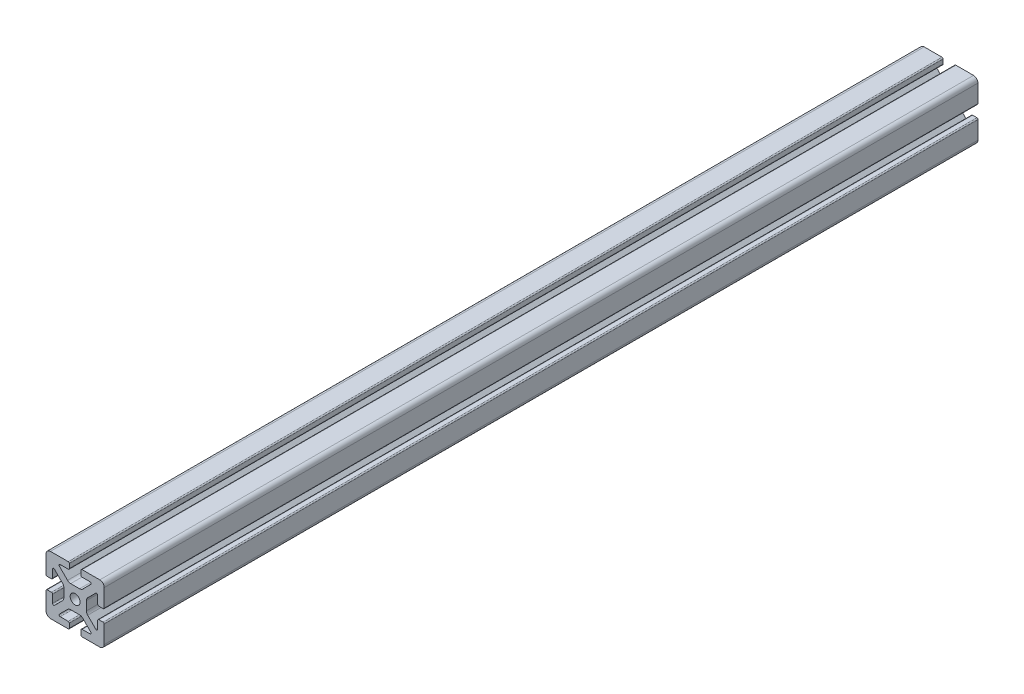
from build123d import *

# Parameters (mm, degrees)
SKETCH1_R           = 3.4036
BOSS_EXTRUDE1_DEPTH = 300


with BuildPart() as part:
    # Sketch1 → Boss-Extrude1 (new, symmetric)
    with BuildSketch(Plane.XY):
        with BuildLine():
            Line((-20, 16.952), (-20, 4.7625))
            ThreePointArc((-20, 4.7625), (-19.776815367, 4.223684633), (-19.238, 4.0005))
            Line((-19.238, 4.0005), (-16.2662, 4.0005))
            ThreePointArc((-16.2662, 4.0005), (-15.727384633, 4.223684633), (-15.5042, 4.7625))
            Line((-15.5042, 4.7625), (-15.5042, 10.2235))
            ThreePointArc((-15.5042, 10.2235), (-15.033804775, 10.927496204), (-14.203384633, 10.762315367))
            Line((-14.203384633, 10.762315367), (-8.635059555, 5.19399029))
            ThreePointArc((-8.635059555, 5.19399029), (-7.985348265, 4.221628629), (-7.7572, 3.074649845))
            Line((-7.7572, 3.074649845), (-7.7572, -3.074649845))
            ThreePointArc((-7.7572, -3.074649845), (-7.985348265, -4.221628629), (-8.635059555, -5.19399029))
            Line((-8.635059555, -5.19399029), (-14.203384633, -10.762315367))
            ThreePointArc((-14.203384633, -10.762315367), (-15.033804775, -10.927496204), (-15.5042, -10.2235))
            Line((-15.5042, -10.2235), (-15.5042, -4.7625))
            ThreePointArc((-15.5042, -4.7625), (-15.727384633, -4.223684633), (-16.2662, -4.0005))
            Line((-16.2662, -4.0005), (-19.238, -4.0005))
            ThreePointArc((-19.238, -4.0005), (-19.776815367, -4.223684633), (-20, -4.7625))
            Line((-20, -4.7625), (-20, -16.952))
            ThreePointArc((-20, -16.952), (-19.107261469, -19.107261469), (-16.952, -20))
            Line((-16.952, -20), (-4.7625, -20))
            ThreePointArc((-4.7625, -20), (-4.223684633, -19.776815367), (-4.0005, -19.238))
            Line((-4.0005, -19.238), (-4.0005, -16.2662))
            ThreePointArc((-4.0005, -16.2662), (-4.223684633, -15.727384633), (-4.7625, -15.5042))
            Line((-4.7625, -15.5042), (-10.2235, -15.5042))
            ThreePointArc((-10.2235, -15.5042), (-10.927496204, -15.033804775), (-10.762315367, -14.203384633))
            Line((-10.762315367, -14.203384633), (-5.19399029, -8.635059555))
            ThreePointArc((-5.19399029, -8.635059555), (-4.221628629, -7.985348265), (-3.074649845, -7.7572))
            Line((-3.074649845, -7.7572), (3.074649845, -7.7572))
            ThreePointArc((3.074649845, -7.7572), (4.221628629, -7.985348265), (5.19399029, -8.635059555))
            Line((5.19399029, -8.635059555), (10.762315367, -14.203384633))
            ThreePointArc((10.762315367, -14.203384633), (10.927496204, -15.033804775), (10.2235, -15.5042))
            Line((10.2235, -15.5042), (4.7625, -15.5042))
            ThreePointArc((4.7625, -15.5042), (4.223684633, -15.727384633), (4.0005, -16.2662))
            Line((4.0005, -16.2662), (4.0005, -19.238))
            ThreePointArc((4.0005, -19.238), (4.223684633, -19.776815367), (4.7625, -20))
            Line((4.7625, -20), (16.952, -20))
            ThreePointArc((16.952, -20), (19.107261469, -19.107261469), (20, -16.952))
            Line((20, -16.952), (20, -4.7625))
            ThreePointArc((20, -4.7625), (19.776815367, -4.223684633), (19.238, -4.0005))
            Line((19.238, -4.0005), (16.2662, -4.0005))
            ThreePointArc((16.2662, -4.0005), (15.727384633, -4.223684633), (15.5042, -4.7625))
            Line((15.5042, -4.7625), (15.5042, -10.2235))
            ThreePointArc((15.5042, -10.2235), (15.033804775, -10.927496204), (14.203384633, -10.762315367))
            Line((14.203384633, -10.762315367), (8.635059555, -5.19399029))
            ThreePointArc((8.635059555, -5.19399029), (7.985348265, -4.221628629), (7.7572, -3.074649845))
            Line((7.7572, -3.074649845), (7.7572, 3.074649845))
            ThreePointArc((7.7572, 3.074649845), (7.985348265, 4.221628629), (8.635059555, 5.19399029))
            Line((8.635059555, 5.19399029), (14.203384633, 10.762315367))
            ThreePointArc((14.203384633, 10.762315367), (15.033804775, 10.927496204), (15.5042, 10.2235))
            Line((15.5042, 10.2235), (15.5042, 4.7625))
            ThreePointArc((15.5042, 4.7625), (15.727384633, 4.223684633), (16.2662, 4.0005))
            Line((16.2662, 4.0005), (19.238, 4.0005))
            ThreePointArc((19.238, 4.0005), (19.776815367, 4.223684633), (20, 4.7625))
            Line((20, 4.7625), (20, 16.952))
            ThreePointArc((20, 16.952), (19.107261469, 19.107261469), (16.952, 20))
            Line((16.952, 20), (4.7625, 20))
            ThreePointArc((4.7625, 20), (4.223684633, 19.776815367), (4.0005, 19.238))
            Line((4.0005, 19.238), (4.0005, 16.2662))
            ThreePointArc((4.0005, 16.2662), (4.223684633, 15.727384633), (4.7625, 15.5042))
            Line((4.7625, 15.5042), (10.2235, 15.5042))
            ThreePointArc((10.2235, 15.5042), (10.927496204, 15.033804775), (10.762315367, 14.203384633))
            Line((10.762315367, 14.203384633), (5.19399029, 8.635059555))
            ThreePointArc((5.19399029, 8.635059555), (4.221628629, 7.985348265), (3.074649845, 7.7572))
            Line((3.074649845, 7.7572), (-3.074649845, 7.7572))
            ThreePointArc((-3.074649845, 7.7572), (-4.221628629, 7.985348265), (-5.19399029, 8.635059555))
            Line((-5.19399029, 8.635059555), (-10.762315367, 14.203384633))
            ThreePointArc((-10.762315367, 14.203384633), (-10.927496204, 15.033804775), (-10.2235, 15.5042))
            Line((-10.2235, 15.5042), (-4.7625, 15.5042))
            ThreePointArc((-4.7625, 15.5042), (-4.223684633, 15.727384633), (-4.0005, 16.2662))
            Line((-4.0005, 16.2662), (-4.0005, 19.238))
            ThreePointArc((-4.0005, 19.238), (-4.223684633, 19.776815367), (-4.7625, 20))
            Line((-4.7625, 20), (-16.952, 20))
            ThreePointArc((-16.952, 20), (-19.107261469, 19.107261469), (-20, 16.952))
        make_face()
        Circle(SKETCH1_R, mode=Mode.SUBTRACT)
    extrude(amount=BOSS_EXTRUDE1_DEPTH, both=True)


solid = part.part
